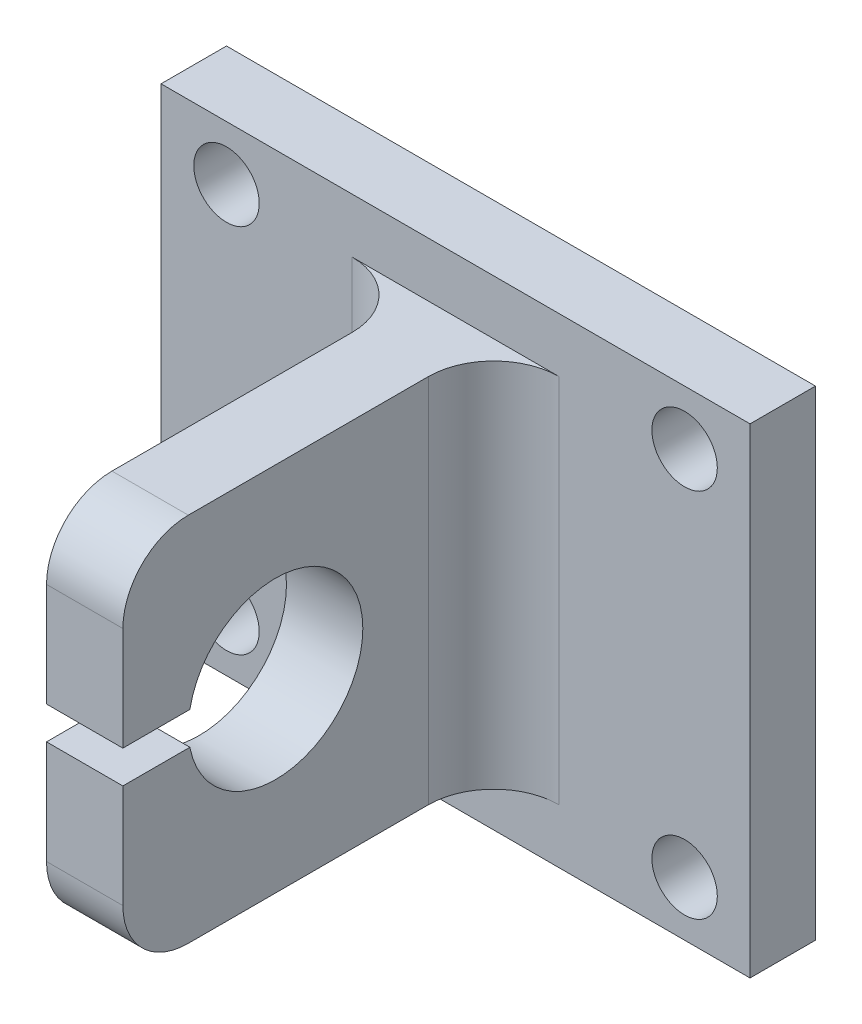
from build123d import *

# Parameters (mm, degrees)
SKETCH1_W               = 27
SKETCH1_H               = 22
SKETCH1_R               = 1.5
BOSS_EXTRUDE1_DEPTH     = 3
SKETCH2_W               = 3.5
SKETCH2_H               = 17
BOSS_EXTRUDE2_DEPTH     = 17
CUT_EXTRUDE1_DEPTH      = 28.451092874
CUT_EXTRUDE1_DEPTH_BACK = 28.451092874
SKETCH3_R               = 4
CUT_EXTRUDE2_DEPTH      = 28.451092874
CUT_EXTRUDE2_DEPTH_BACK = 28.451092874
SKETCH4_W               = 8.09758535
SKETCH4_H               = 1.5
FILLET1_R               = 3
FILLET2_R               = 3


with BuildPart() as part:
    # Sketch1 → Boss-Extrude1 (new body)
    with BuildSketch(Plane.XY):
        Rectangle(SKETCH1_W, SKETCH1_H)
        with Locations((10.5, 8.5)):
            Circle(SKETCH1_R, mode=Mode.SUBTRACT)
        with Locations((10.5, -8.5)):
            Circle(SKETCH1_R, mode=Mode.SUBTRACT)
        with Locations((-10.5, -8.5)):
            Circle(SKETCH1_R, mode=Mode.SUBTRACT)
        with Locations((-10.5, 8.5)):
            Circle(SKETCH1_R, mode=Mode.SUBTRACT)
    extrude(amount=BOSS_EXTRUDE1_DEPTH)

    # Sketch2 → Boss-Extrude2 (add)
    with BuildSketch(Plane.XY.offset(3)):
        Rectangle(SKETCH2_W, SKETCH2_H)
    extrude(amount=BOSS_EXTRUDE2_DEPTH)

    # Sketch3 → Cut-Extrude1 (cut, two sides: drawn at the far end of the back side and taken through both)
    with BuildSketch(Plane(origin=(1.75, 0, 0), x_dir=(0, 0, -1), z_dir=(1, 0, 0)).offset(-CUT_EXTRUDE1_DEPTH_BACK)):
        with Locations(Location((-13, 0, 0), (0, 0, 90))):
            Circle(SKETCH3_R)
    extrude(amount=CUT_EXTRUDE1_DEPTH + CUT_EXTRUDE1_DEPTH_BACK, mode=Mode.SUBTRACT)

    # Sketch4 → Cut-Extrude2 (cut, two sides: drawn at the far end of the back side and taken through both)
    with BuildSketch(Plane(origin=(1.75, 0, 0), x_dir=(0, 0, -1), z_dir=(1, 0, 0)).offset(-CUT_EXTRUDE2_DEPTH_BACK)):
        with Locations((-18.330812417, 0)):
            Rectangle(SKETCH4_W, SKETCH4_H)
    extrude(amount=CUT_EXTRUDE2_DEPTH + CUT_EXTRUDE2_DEPTH_BACK, mode=Mode.SUBTRACT)

    # Fillet1
    fillet1_edges = [part.edges().sort_by_distance(p)[0] for p in [
        (-1.75, 0, 3),
        (1.75, 0, 3),
    ]]
    fillet(fillet1_edges, radius=FILLET1_R)

    # Fillet2
    fillet2_edges = [part.edges().sort_by_distance(p)[0] for p in [
        (0, -8.5, 20),
        (0, 8.5, 20),
    ]]
    fillet(fillet2_edges, radius=FILLET2_R)


solid = part.part
